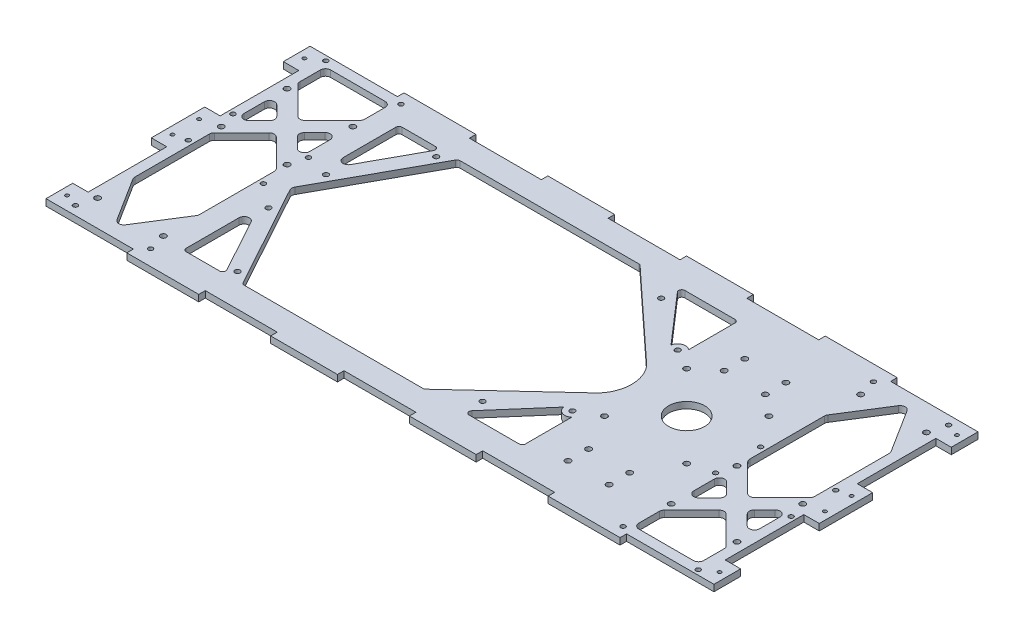
from build123d import *

# Parameters (mm, degrees)
SKETCH1_W           = 619.98
SKETCH1_H           = 269.7
BOSS_EXTRUDE1_DEPTH = 6.35
SKETCH3_R           = 2.75
CUT_EXTRUDE1_DEPTH  = 6.35
CUT_EXTRUDE2_DEPTH  = 6.35
SKETCH7_R           = 17.5
SKETCH7_R_2         = 2.75
CUT_EXTRUDE3_DEPTH  = 6.35
CUT_EXTRUDE4_DEPTH  = 6.35
SKETCH9_W           = 70
SKETCH9_H           = 6.36
CUT_EXTRUDE5_DEPTH  = 6.35
CUT_EXTRUDE6_DEPTH  = 10
BOSS_EXTRUDE2_DEPTH = 6.35
SKETCH14_R          = 7.5
SKETCH14_R_2        = 2.5
BOSS_EXTRUDE3_DEPTH = 6.35
SKETCH15_W          = 15
SKETCH15_H          = 26
SKETCH15_H_2        = 52
BOSS_EXTRUDE4_DEPTH = 6.35
SKETCH16_R          = 1.75
CUT_EXTRUDE7_DEPTH  = 25
SKETCH18_R          = 2.5
CUT_EXTRUDE8_DEPTH  = 25
SKETCH19_W          = 330
SKETCH19_H          = 16
BOSS_EXTRUDE5_DEPTH = 6.35
FILLET1_R           = 3
SKETCH20_R          = 2.25
CUT_EXTRUDE9_DEPTH  = 6.35


with BuildPart() as part:
    # Sketch1 → Boss-Extrude1 (new body)
    with BuildSketch(Plane(origin=(0, 0, 0), x_dir=(1, 0, 0), z_dir=(0, 1, 0))):
        Rectangle(SKETCH1_W, SKETCH1_H)
    extrude(amount=BOSS_EXTRUDE1_DEPTH)

    # Sketch3 → Cut-Extrude1 (cut)
    with BuildSketch(Plane(origin=(0, 6.35, 0), x_dir=(1, 0, 0), z_dir=(0, 1, 0))):
        with Locations(Location((-300.44, -102.85, 0), (0, 0, 270))):
            Circle(SKETCH3_R)
        with Locations(Location((-236.44, -102.85, 0), (0, 0, 270))):
            Circle(SKETCH3_R)
        with Locations(Location((-300.44, 17.52, 0), (0, 0, 270))):
            Circle(SKETCH3_R)
        with Locations(Location((-236.44, 17.52, 0), (0, 0, 270))):
            Circle(SKETCH3_R)
        with Locations(Location((-236.44, 81.52, 0), (0, 0, 270))):
            Circle(SKETCH3_R)
        with Locations(Location((-300.44, 81.52, 0), (0, 0, 270))):
            Circle(SKETCH3_R)
        with Locations(Location((300.44, 102.85, 0), (0, 0, 270))):
            Circle(SKETCH3_R)
        with Locations(Location((236.44, 102.85, 0), (0, 0, 270))):
            Circle(SKETCH3_R)
        with Locations(Location((300.44, -17.52, 0), (0, 0, 270))):
            Circle(SKETCH3_R)
        with Locations(Location((236.44, -17.52, 0), (0, 0, 270))):
            Circle(SKETCH3_R)
        with Locations(Location((236.44, -81.52, 0), (0, 0, 270))):
            Circle(SKETCH3_R)
        with Locations(Location((300.44, -81.52, 0), (0, 0, 270))):
            Circle(SKETCH3_R)
    extrude(amount=-CUT_EXTRUDE1_DEPTH, mode=Mode.SUBTRACT)

    # Sketch6 → Cut-Extrude2 (cut)
    with BuildSketch(Plane(origin=(0, 6.35, 0), x_dir=(1, 0, 0), z_dir=(0, 1, 0))):
        with BuildLine():
            Line((-299.218549437, -69.712584093), (-272.668549437, -111.788653824))
            ThreePointArc((-272.668549437, -111.788653824), (-268.44, -114.120439129), (-264.211450563, -111.788653824))
            Line((-264.211450563, -111.788653824), (-237.661450563, -69.712584093))
            ThreePointArc((-237.661450563, -69.712584093), (-237.086733029, -68.433119343), (-236.89, -67.044369398))
            Line((-236.89, -67.044369398), (-236.89, 5.448932188))
            ThreePointArc((-236.89, 5.448932188), (-237.270602337, 7.36234935), (-238.354466094, 8.984466094))
            Line((-238.354466094, 8.984466094), (-264.904466094, 35.534466094))
            ThreePointArc((-264.904466094, 35.534466094), (-268.44, 36.998932188), (-271.975533906, 35.534466094))
            Line((-271.975533906, 35.534466094), (-298.525533906, 8.984466094))
            ThreePointArc((-298.525533906, 8.984466094), (-299.609397663, 7.36234935), (-299.99, 5.448932188))
            Line((-299.99, 5.448932188), (-299.99, -67.044369398))
            ThreePointArc((-299.99, -67.044369398), (-299.793266971, -68.433119343), (-299.218549437, -69.712584093))
        make_face()
        with BuildLine():
            Line((-300.44, 59.448932188), (-300.44, 39.591067812))
            ThreePointArc((-300.44, 39.591067812), (-297.353417162, 34.971670149), (-291.904466094, 36.055533906))
            Line((-291.904466094, 36.055533906), (-281.975533906, 45.984466094))
            ThreePointArc((-281.975533906, 45.984466094), (-280.511067812, 49.52), (-281.975533906, 53.055533906))
            Line((-281.975533906, 53.055533906), (-291.904466094, 62.984466094))
            ThreePointArc((-291.904466094, 62.984466094), (-297.353417162, 64.068329851), (-300.44, 59.448932188))
        make_face()
        with BuildLine():
            Line((-254.904466094, 53.055533906), (-244.975533906, 62.984466094))
            ThreePointArc((-244.975533906, 62.984466094), (-239.526582838, 64.068329851), (-236.44, 59.448932188))
            Line((-236.44, 59.448932188), (-236.44, 39.591067812))
            ThreePointArc((-236.44, 39.591067812), (-239.526582838, 34.971670149), (-244.975533906, 36.055533906))
            Line((-244.975533906, 36.055533906), (-254.904466094, 45.984466094))
            ThreePointArc((-254.904466094, 45.984466094), (-256.368932188, 49.52), (-254.904466094, 53.055533906))
        make_face()
        with BuildLine():
            Line((-299.99, 113.49), (-299.99, 93.591067812))
            ThreePointArc((-299.99, 93.591067812), (-299.609397663, 91.67765065), (-298.525533906, 90.055533906))
            Line((-298.525533906, 90.055533906), (-271.975533906, 63.505533906))
            ThreePointArc((-271.975533906, 63.505533906), (-268.44, 62.041067812), (-264.904466094, 63.505533906))
            Line((-264.904466094, 63.505533906), (-238.354466094, 90.055533906))
            ThreePointArc((-238.354466094, 90.055533906), (-237.270602337, 91.67765065), (-236.89, 93.591067812))
            Line((-236.89, 93.591067812), (-236.89, 113.49))
            ThreePointArc((-236.89, 113.49), (-238.354466094, 117.025533906), (-241.89, 118.49))
            Line((-241.89, 118.49), (-294.99, 118.49))
            ThreePointArc((-294.99, 118.49), (-298.525533906, 117.025533906), (-299.99, 113.49))
        make_face()
        with BuildLine():
            Line((299.218549437, 69.712584093), (272.668549437, 111.788653824))
            ThreePointArc((272.668549437, 111.788653824), (268.44, 114.120439129), (264.211450563, 111.788653824))
            Line((264.211450563, 111.788653824), (237.661450563, 69.712584093))
            ThreePointArc((237.661450563, 69.712584093), (237.086733029, 68.433119343), (236.89, 67.044369398))
            Line((236.89, 67.044369398), (236.89, -5.448932188))
            ThreePointArc((236.89, -5.448932188), (237.270602337, -7.36234935), (238.354466094, -8.984466094))
            Line((238.354466094, -8.984466094), (264.904466094, -35.534466094))
            ThreePointArc((264.904466094, -35.534466094), (268.44, -36.998932188), (271.975533906, -35.534466094))
            Line((271.975533906, -35.534466094), (298.525533906, -8.984466094))
            ThreePointArc((298.525533906, -8.984466094), (299.609397663, -7.36234935), (299.99, -5.448932188))
            Line((299.99, -5.448932188), (299.99, 67.044369398))
            ThreePointArc((299.99, 67.044369398), (299.793266971, 68.433119343), (299.218549437, 69.712584093))
        make_face()
        with BuildLine():
            Line((300.44, -59.448932188), (300.44, -39.591067812))
            ThreePointArc((300.44, -39.591067812), (297.353417162, -34.971670149), (291.904466094, -36.055533906))
            Line((291.904466094, -36.055533906), (281.975533906, -45.984466094))
            ThreePointArc((281.975533906, -45.984466094), (280.511067812, -49.52), (281.975533906, -53.055533906))
            Line((281.975533906, -53.055533906), (291.904466094, -62.984466094))
            ThreePointArc((291.904466094, -62.984466094), (297.353417162, -64.068329851), (300.44, -59.448932188))
        make_face()
        with BuildLine():
            Line((254.904466094, -53.055533906), (244.975533906, -62.984466094))
            ThreePointArc((244.975533906, -62.984466094), (239.526582838, -64.068329851), (236.44, -59.448932188))
            Line((236.44, -59.448932188), (236.44, -39.591067812))
            ThreePointArc((236.44, -39.591067812), (239.526582838, -34.971670149), (244.975533906, -36.055533906))
            Line((244.975533906, -36.055533906), (254.904466094, -45.984466094))
            ThreePointArc((254.904466094, -45.984466094), (256.368932188, -49.52), (254.904466094, -53.055533906))
        make_face()
        with BuildLine():
            Line((299.99, -113.49), (299.99, -93.591067812))
            ThreePointArc((299.99, -93.591067812), (299.609397663, -91.67765065), (298.525533906, -90.055533906))
            Line((298.525533906, -90.055533906), (271.975533906, -63.505533906))
            ThreePointArc((271.975533906, -63.505533906), (268.44, -62.041067812), (264.904466094, -63.505533906))
            Line((264.904466094, -63.505533906), (238.354466094, -90.055533906))
            ThreePointArc((238.354466094, -90.055533906), (237.270602337, -91.67765065), (236.89, -93.591067812))
            Line((236.89, -93.591067812), (236.89, -113.49))
            ThreePointArc((236.89, -113.49), (238.354466094, -117.025533906), (241.89, -118.49))
            Line((241.89, -118.49), (294.99, -118.49))
            ThreePointArc((294.99, -118.49), (298.525533906, -117.025533906), (299.99, -113.49))
        make_face()
    extrude(amount=-CUT_EXTRUDE2_DEPTH, mode=Mode.SUBTRACT)

    # Sketch7 → Cut-Extrude3 (cut)
    with BuildSketch(Plane(origin=(0, 6.35, 0), x_dir=(1, 0, 0), z_dir=(0, 1, 0))):
        with Locations(Location((169.99, 0, 0), (0, 0, 270))):
            Circle(SKETCH7_R)
        with Locations(Location((129.99, 40, 0), (0, 0, 270))):
            Circle(SKETCH7_R_2)
        with Locations(Location((209.99, 40, 0), (0, 0, 270))):
            Circle(SKETCH7_R_2)
        with Locations(Location((209.99, -40, 0), (0, 0, 270))):
            Circle(SKETCH7_R_2)
        with Locations(Location((129.99, -40, 0), (0, 0, 270))):
            Circle(SKETCH7_R_2)
        with Locations(Location((149.99, 76.5, 0), (0, 0, 270))):
            Circle(SKETCH7_R_2)
        with Locations(Location((189.99, 76.5, 0), (0, 0, 270))):
            Circle(SKETCH7_R_2)
        with Locations(Location((189.99, 56.5, 0), (0, 0, 270))):
            Circle(SKETCH7_R_2)
        with Locations(Location((149.99, 56.5, 0), (0, 0, 270))):
            Circle(SKETCH7_R_2)
        with Locations(Location((149.99, -75.5, 0), (0, 0, 90))):
            Circle(SKETCH7_R_2)
        with Locations(Location((189.99, -75.5, 0), (0, 0, 90))):
            Circle(SKETCH7_R_2)
        with Locations(Location((189.99, -95.5, 0), (0, 0, 90))):
            Circle(SKETCH7_R_2)
        with Locations(Location((149.99, -95.5, 0), (0, 0, 90))):
            Circle(SKETCH7_R_2)
    extrude(amount=-CUT_EXTRUDE3_DEPTH, mode=Mode.SUBTRACT)

    # Sketch8 → Cut-Extrude4 (cut)
    with BuildSketch(Plane(origin=(0, 6.35, 0), x_dir=(1, 0, 0), z_dir=(0, 1, 0))):
        with BuildLine():
            Line((104.025499566, 15), (30, 15))
            ThreePointArc((30, 15), (26.464466094, 16.464466094), (25, 20))
            Line((25, 20), (25, 105.121099445))
            ThreePointArc((25, 105.121099445), (28.248479686, 109.804279624), (33.772870636, 108.402173532))
            Line((33.772870636, 108.402173532), (107.798370202, 23.281074087))
            ThreePointArc((107.798370202, 23.281074087), (108.575519919, 17.927003429), (104.025499566, 15))
        make_face()
        with BuildLine():
            Line((3.680812264, 2.404777768), (-58.576340239, 115.894777768))
            ThreePointArc((-58.576340239, 115.894777768), (-60.41289894, 117.79255092), (-62.960065126, 118.49))
            Line((-62.960065126, 118.49), (-147.039934874, 118.49))
            ThreePointArc((-147.039934874, 118.49), (-149.58710106, 117.79255092), (-151.423659761, 115.894777768))
            Line((-151.423659761, 115.894777768), (-213.680812264, 2.404777768))
            ThreePointArc((-213.680812264, 2.404777768), (-214.297087376, 0), (-213.680812264, -2.404777768))
            Line((-213.680812264, -2.404777768), (-151.423659761, -115.894777768))
            ThreePointArc((-151.423659761, -115.894777768), (-149.58710106, -117.79255092), (-147.039934874, -118.49))
            Line((-147.039934874, -118.49), (-62.960065126, -118.49))
            ThreePointArc((-62.960065126, -118.49), (-60.41289894, -117.79255092), (-58.576340239, -115.894777768))
            Line((-58.576340239, -115.894777768), (3.680812264, -2.404777768))
            ThreePointArc((3.680812264, -2.404777768), (4.297087376, 0), (3.680812264, 2.404777768))
        make_face()
        with BuildLine():
            Line((115, -51.227268886), (115, -113.49))
            ThreePointArc((115, -113.49), (113.535533906, -117.025533906), (110, -118.49))
            Line((110, -118.49), (55.853263115, -118.49))
            ThreePointArc((55.853263115, -118.49), (51.303242762, -115.562996571), (52.080392479, -110.208925913))
            Line((52.080392479, -110.208925913), (106.227129364, -47.9461948))
            ThreePointArc((106.227129364, -47.9461948), (111.751520314, -46.544088707), (115, -51.227268886))
        make_face()
        with BuildLine():
            Line((52.080392479, 110.208925913), (106.227129364, 47.9461948))
            ThreePointArc((106.227129364, 47.9461948), (111.751520314, 46.544088707), (115, 51.227268886))
            Line((115, 51.227268886), (115, 113.49))
            ThreePointArc((115, 113.49), (113.535533906, 117.025533906), (110, 118.49))
            Line((110, 118.49), (55.853263115, 118.49))
            ThreePointArc((55.853263115, 118.49), (51.303242762, 115.562996571), (52.080392479, 110.208925913))
        make_face()
        with BuildLine():
            Line((25, -20), (25, -105.121099445))
            ThreePointArc((25, -105.121099445), (28.248479686, -109.804279624), (33.772870636, -108.402173532))
            Line((33.772870636, -108.402173532), (107.798370202, -23.281074087))
            ThreePointArc((107.798370202, -23.281074087), (108.575519919, -17.927003429), (104.025499566, -15))
            Line((104.025499566, -15), (30, -15))
            ThreePointArc((30, -15), (26.464466094, -16.464466094), (25, -20))
        make_face()
        with BuildLine():
            Line((-34.445502007, 118.49), (0, 118.49))
            ThreePointArc((0, 118.49), (3.535533906, 117.025533906), (5, 113.49))
            Line((5, 113.49), (5, 50.698499496))
            ThreePointArc((5, 50.698499496), (1.241244449, 45.85501808), (-4.383724887, 48.293721728))
            Line((-4.383724887, 48.293721728), (-38.829226894, 111.085222232))
            ThreePointArc((-38.829226894, 111.085222232), (-38.748052927, 116.037166186), (-34.445502007, 118.49))
        make_face()
        with BuildLine():
            Line((-175.554497993, 118.49), (-210, 118.49))
            ThreePointArc((-210, 118.49), (-213.535533906, 117.025533906), (-215, 113.49))
            Line((-215, 113.49), (-215, 50.698499496))
            ThreePointArc((-215, 50.698499496), (-211.241244449, 45.85501808), (-205.616275113, 48.293721728))
            Line((-205.616275113, 48.293721728), (-171.170773106, 111.085222232))
            ThreePointArc((-171.170773106, 111.085222232), (-171.251947073, 116.037166186), (-175.554497993, 118.49))
        make_face()
        with BuildLine():
            Line((-205.616275113, -48.293721728), (-171.170773106, -111.085222232))
            ThreePointArc((-171.170773106, -111.085222232), (-171.251947073, -116.037166186), (-175.554497993, -118.49))
            Line((-175.554497993, -118.49), (-210, -118.49))
            ThreePointArc((-210, -118.49), (-213.535533906, -117.025533906), (-215, -113.49))
            Line((-215, -113.49), (-215, -50.698499496))
            ThreePointArc((-215, -50.698499496), (-211.241244449, -45.85501808), (-205.616275113, -48.293721728))
        make_face()
        with BuildLine():
            Line((5, -113.49), (5, -50.698499496))
            ThreePointArc((5, -50.698499496), (1.241244449, -45.85501808), (-4.383724887, -48.293721728))
            Line((-4.383724887, -48.293721728), (-38.829226894, -111.085222232))
            ThreePointArc((-38.829226894, -111.085222232), (-38.748052927, -116.037166186), (-34.445502007, -118.49))
            Line((-34.445502007, -118.49), (0, -118.49))
            ThreePointArc((0, -118.49), (3.535533906, -117.025533906), (5, -113.49))
        make_face()
    extrude(amount=-CUT_EXTRUDE4_DEPTH, mode=Mode.SUBTRACT)

    # Sketch9 → Cut-Extrude5 (cut)
    with BuildSketch(Plane(origin=(0, 6.35, 0), x_dir=(1, 0, 0), z_dir=(0, 1, 0))):
        with Locations((-274.99, -131.67)):
            Rectangle(SKETCH9_W, SKETCH9_H)
        with Locations((-134.99, -131.67)):
            Rectangle(SKETCH9_W, SKETCH9_H)
        with Locations((0, -131.67)):
            Rectangle(SKETCH9_W, SKETCH9_H)
        with Locations((274.99, -131.67)):
            Rectangle(SKETCH9_W, SKETCH9_H)
        with Locations((134.99, -131.67)):
            Rectangle(SKETCH9_W, SKETCH9_H)
    cut_extrude5 = extrude(amount=-CUT_EXTRUDE5_DEPTH, mode=Mode.SUBTRACT)

    # Mirror1: Cut-Extrude5 across plane
    add(cut_extrude5.mirror(Plane.XY), mode=Mode.SUBTRACT)

    # Sketch11 → Cut-Extrude6 (cut)
    with BuildSketch(Plane(origin=(0, 6.35, 0), x_dir=(1, 0, 0), z_dir=(0, 1, 0))):
        with BuildLine():
            Line((-70.645052416, 118.49), (25, 118.49))
            Line((25, 118.49), (107.798370202, 23.281074087))
            ThreePointArc((107.798370202, 23.281074087), (116.50554623, 0), (107.798370202, -23.281074087))
            Line((107.798370202, -23.281074087), (25, -118.49))
            Line((25, -118.49), (-70.645052416, -118.49))
            Line((-70.645052416, -118.49), (-70.645052416, 118.49))
        make_face()
    extrude(amount=-CUT_EXTRUDE6_DEPTH, mode=Mode.SUBTRACT)

    # Sketch12 → Boss-Extrude2 (add)
    with BuildSketch(Plane(origin=(0, 6.35, 0), x_dir=(1, 0, 0), z_dir=(0, 1, 0))):
        Polygon((5, -118.49), (107.798370202, -23.281074087), (25, -118.49), align=None)
        Polygon((107.798370202, 23.281074087), (25, 118.49), (5, 118.49), align=None)
    extrude(amount=-BOSS_EXTRUDE2_DEPTH)

    # Sketch14 → Boss-Extrude3 (add)
    # profile 1 of 2: a face of its own
    with BuildSketch(Plane(origin=(0, 6.35, 0), x_dir=(1, 0, 0), z_dir=(0, 1, 0))):
        with Locations((110, 51.227268886)):
            Circle(SKETCH14_R)
        with Locations(Location((110, 51.227268886, 0), (0, 0, 270))):
            Circle(SKETCH14_R_2, mode=Mode.SUBTRACT)
    # profile 2 of 2: a face of its own
    with BuildSketch(Plane(origin=(0, 6.35, 0), x_dir=(1, 0, 0), z_dir=(0, 1, 0))):
        with Locations((110, -51.227268886)):
            Circle(SKETCH14_R)
        with Locations(Location((110, -51.227268886, 0), (0, 0, 270))):
            Circle(SKETCH14_R_2, mode=Mode.SUBTRACT)
    extrude(amount=-BOSS_EXTRUDE3_DEPTH)

    # Sketch15 → Boss-Extrude4 (add)
    with BuildSketch(Plane(origin=(0, 6.35, 0), x_dir=(1, 0, 0), z_dir=(0, 1, 0))):
        with Locations((-317.49, -115.49)):
            Rectangle(SKETCH15_W, SKETCH15_H)
        with Locations((-317.49, 0)):
            Rectangle(SKETCH15_W, SKETCH15_H_2)
        with Locations((-317.49, 115.49)):
            Rectangle(SKETCH15_W, SKETCH15_H)
    boss_extrude4 = extrude(amount=-BOSS_EXTRUDE4_DEPTH)

    # Sketch16 → Cut-Extrude7 (cut)
    with BuildSketch(Plane(origin=(0, 6.35, 0), x_dir=(1, 0, 0), z_dir=(0, 1, 0))):
        with Locations(Location((-317.49, 115.49, 0), (0, 0, 270))):
            Circle(SKETCH16_R)
        with Locations(Location((-317.49, 13, 0), (0, 0, 270))):
            Circle(SKETCH16_R)
        with Locations(Location((-317.49, -13, 0), (0, 0, 270))):
            Circle(SKETCH16_R)
        with Locations(Location((-317.49, -115.49, 0), (0, 0, 270))):
            Circle(SKETCH16_R)
    cut_extrude7 = extrude(amount=-CUT_EXTRUDE7_DEPTH, mode=Mode.SUBTRACT)

    # Mirror2: Boss-Extrude4, Cut-Extrude7 across plane
    add(boss_extrude4.mirror(Plane(origin=(0, 0, 0), x_dir=(0, 0, 1), z_dir=(1, 0, 0))))
    add(cut_extrude7.mirror(Plane(origin=(0, 0, 0), x_dir=(0, 0, 1), z_dir=(1, 0, 0))), mode=Mode.SUBTRACT)

    # Sketch18 → Cut-Extrude8 (cut)
    with BuildSketch(Plane(origin=(0, 6.35, 0), x_dir=(1, 0, 0), z_dir=(0, 1, 0))):
        with Locations(Location((-170.496673375, 96.720097646, 0), (0, 0, 270))):
            Circle(SKETCH18_R)
        with Locations(Location((-170.496673375, -96.720097646, 0), (0, 0, 270))):
            Circle(SKETCH18_R)
        with Locations(Location((58.250305155, -86.890200299, 0), (0, 0, 270))):
            Circle(SKETCH18_R)
        with Locations(Location((58.250305155, 86.890200299, 0), (0, 0, 270))):
            Circle(SKETCH18_R)
        with Locations(Location((-209, 28, 0), (0, 0, 270))):
            Circle(SKETCH18_R)
        with Locations(Location((-209, -28, 0), (0, 0, 270))):
            Circle(SKETCH18_R)
    extrude(amount=-CUT_EXTRUDE8_DEPTH, mode=Mode.SUBTRACT)

    # Sketch19 → Boss-Extrude5 (add)
    with BuildSketch(Plane(origin=(0, 6.35, 0), x_dir=(1, 0, 0), z_dir=(0, 1, 0))):
        with Locations((-50, -113)):
            Rectangle(SKETCH19_W, SKETCH19_H)
        with Locations((-50, 113)):
            Rectangle(SKETCH19_W, SKETCH19_H)
    extrude(amount=-BOSS_EXTRUDE5_DEPTH)

    # Fillet1
    fillet1_edges = [part.edges().sort_by_distance(p)[0] for p in [
        (19.565336188, 3.175, 105),
        (-215, 3.175, 105),
        (56.610330948, 3.175, 105),
        (115, 3.175, 105),
        (-174.50894042, 3.175, 105),
        (-157.400202549, 3.175, 105),
        (19.565336188, 3.175, -105),
        (115, 3.175, -105),
        (56.610330948, 3.175, -105),
        (-215, 3.175, -105),
        (-174.50894042, 3.175, -105),
        (-157.400202549, 3.175, -105),
    ]]
    fillet(fillet1_edges, radius=FILLET1_R)

    # Sketch20 → Cut-Extrude9 (cut)
    with BuildSketch(Plane(origin=(0, 0, 0), x_dir=(-1, 0, 0), z_dir=(0, -1, 0))):
        with Locations(Location((-304.99, 119.85, 0), (0, 0, 90))):
            Circle(SKETCH20_R)
        with Locations(Location((-231.89, 119.85, 0), (0, 0, 90))):
            Circle(SKETCH20_R)
        with Locations(Location((-304.99, 10, 0), (0, 0, 90))):
            Circle(SKETCH20_R)
        with Locations(Location((-231.89, 10, 0), (0, 0, 90))):
            Circle(SKETCH20_R)
        with Locations(Location((-305.44, -33.85, 0), (0, 0, 90))):
            Circle(SKETCH20_R)
        with Locations(Location((-231.89, -33.85, 0), (0, 0, 90))):
            Circle(SKETCH20_R)
        with Locations(Location((-304.99, -123.85, 0), (0, 0, 90))):
            Circle(SKETCH20_R)
        with Locations(Location((-232.022169564, -123.965665677, 0), (0, 0, 90))):
            Circle(SKETCH20_R)
        with Locations(Location((231.89, -119.85, 0), (0, 0, 90))):
            Circle(SKETCH20_R)
        with Locations(Location((304.99, -119.85, 0), (0, 0, 90))):
            Circle(SKETCH20_R)
        with Locations(Location((304.99, -10, 0), (0, 0, 90))):
            Circle(SKETCH20_R)
        with Locations(Location((231.89, -10, 0), (0, 0, 90))):
            Circle(SKETCH20_R)
        with Locations(Location((231.89, 33.85, 0), (0, 0, 90))):
            Circle(SKETCH20_R)
        with Locations(Location((305.44, 33.85, 0), (0, 0, 90))):
            Circle(SKETCH20_R)
        with Locations(Location((304.99, 123.85, 0), (0, 0, 90))):
            Circle(SKETCH20_R)
        with Locations(Location((231.89, 123.85, 0), (0, 0, 90))):
            Circle(SKETCH20_R)
    extrude(amount=-CUT_EXTRUDE9_DEPTH, mode=Mode.SUBTRACT)


solid = part.part
